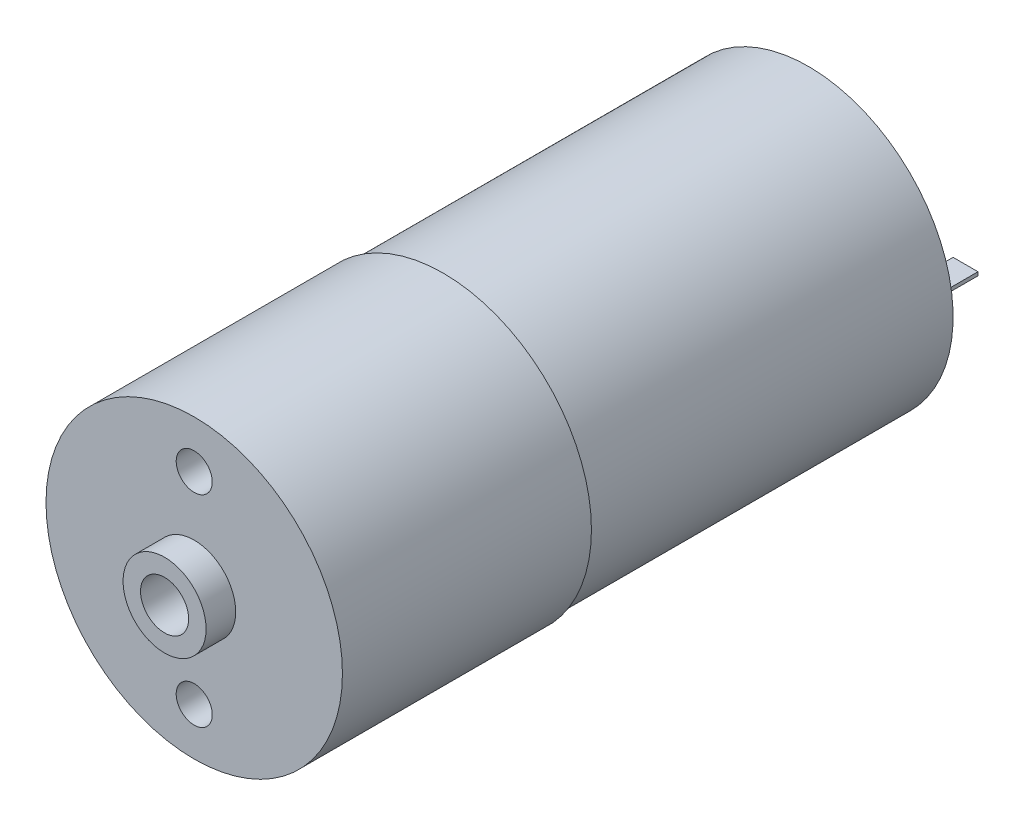
from build123d import *

# Parameters (mm, degrees)
F_01_START                                   = -21
S01_25_MM_47_TO_1_GEARBOX_R                  = 12.5
F_01_25_MM_47_TO_1_GEARBOX_DEPTH             = 21
F_02_START                                   = -51.8
S02_24_4_MM_MOTOR_CAN_R                      = 12.2
F_02_24_4_MM_MOTOR_CAN_DEPTH                 = 30.8
F_03_START                                   = -53.3
S03_REAR_SHAFT_BOSS_R                        = 3.2
F_03_REAR_SHAFT_BOSS_DEPTH                   = 1.5
F_04_START                                   = -56
S04_REAR_MOTOR_TERMINAL_1_W                  = 2.1
S04_REAR_MOTOR_TERMINAL_1_H                  = 0.3
F_04_REAR_MOTOR_TERMINAL_1_DEPTH             = 4.2
F_05_START                                   = -56
S05_REAR_MOTOR_TERMINAL_1_W                  = 2.1
S05_REAR_MOTOR_TERMINAL_1_H                  = 0.3
F_05_REAR_MOTOR_TERMINAL_1_DEPTH             = 4.2
F_06_START                                   = -6
S06_FACE_MOUNTING_M3_THREAD_ENVELOPES_R      = 1.52
F_06_FACE_MOUNTING_M3_THREAD_ENVELOPES_DEPTH = 6.1
S07_MOTOR_SHAFT_PILOT_R                      = 3.5
F_07_MOTOR_SHAFT_PILOT_DEPTH                 = 2.5
F_08_START                                   = -1
S08_OUTPUT_SHAFT_CLEARANCE_R                 = 2.03
F_08_OUTPUT_SHAFT_CLEARANCE_DEPTH            = 3.6


with BuildPart() as part:
    # S01 - 25 mm 47-to-1 gearbox → 01 - 25 mm 47-to-1 gearbox (new body)
    with BuildSketch(Plane.XY.offset(F_01_START)):
        with Locations(Location((0, 0, 0), (0, 0, 180))):
            Circle(S01_25_MM_47_TO_1_GEARBOX_R)
    extrude(amount=F_01_25_MM_47_TO_1_GEARBOX_DEPTH)

    # S02 - 24.4 mm motor can → 02 - 24.4 mm motor can (add)
    with BuildSketch(Plane.XY.offset(F_02_START)):
        with Locations(Location((0, 0, 0), (0, 0, 180))):
            Circle(S02_24_4_MM_MOTOR_CAN_R)
    extrude(amount=F_02_24_4_MM_MOTOR_CAN_DEPTH)

    # S03 - Rear shaft boss → 03 - Rear shaft boss (add)
    with BuildSketch(Plane.XY.offset(F_03_START)):
        Circle(S03_REAR_SHAFT_BOSS_R)
    extrude(amount=F_03_REAR_SHAFT_BOSS_DEPTH)

    # S04 - Rear motor terminal -1 → 04 - Rear motor terminal -1 (add)
    with BuildSketch(Plane.XY.offset(F_04_START)):
        with Locations((-9.05, 0)):
            Rectangle(S04_REAR_MOTOR_TERMINAL_1_W, S04_REAR_MOTOR_TERMINAL_1_H)
    extrude(amount=F_04_REAR_MOTOR_TERMINAL_1_DEPTH)

    # S05 - Rear motor terminal 1 → 05 - Rear motor terminal 1 (add)
    with BuildSketch(Plane.XY.offset(F_05_START)):
        with Locations((9.05, 0)):
            Rectangle(S05_REAR_MOTOR_TERMINAL_1_W, S05_REAR_MOTOR_TERMINAL_1_H)
    extrude(amount=F_05_REAR_MOTOR_TERMINAL_1_DEPTH)

    # S06 - Face mounting M3 thread envelopes → 06 - Face mounting M3 thread envelopes (cut)
    with BuildSketch(Plane.XY.offset(F_06_START)):
        with Locations((0, 8.5)):
            Circle(S06_FACE_MOUNTING_M3_THREAD_ENVELOPES_R)
        with Locations((0, -8.5)):
            Circle(S06_FACE_MOUNTING_M3_THREAD_ENVELOPES_R)
    extrude(amount=F_06_FACE_MOUNTING_M3_THREAD_ENVELOPES_DEPTH, mode=Mode.SUBTRACT)

    # S07 - Motor shaft pilot → 07 - Motor shaft pilot (add)
    with BuildSketch(Plane.XY):
        Circle(S07_MOTOR_SHAFT_PILOT_R)
    extrude(amount=F_07_MOTOR_SHAFT_PILOT_DEPTH)

    # S08 - Output shaft clearance → 08 - Output shaft clearance (cut)
    with BuildSketch(Plane.XY.offset(F_08_START)):
        Circle(S08_OUTPUT_SHAFT_CLEARANCE_R)
    extrude(amount=F_08_OUTPUT_SHAFT_CLEARANCE_DEPTH, mode=Mode.SUBTRACT)


solid = part.part
